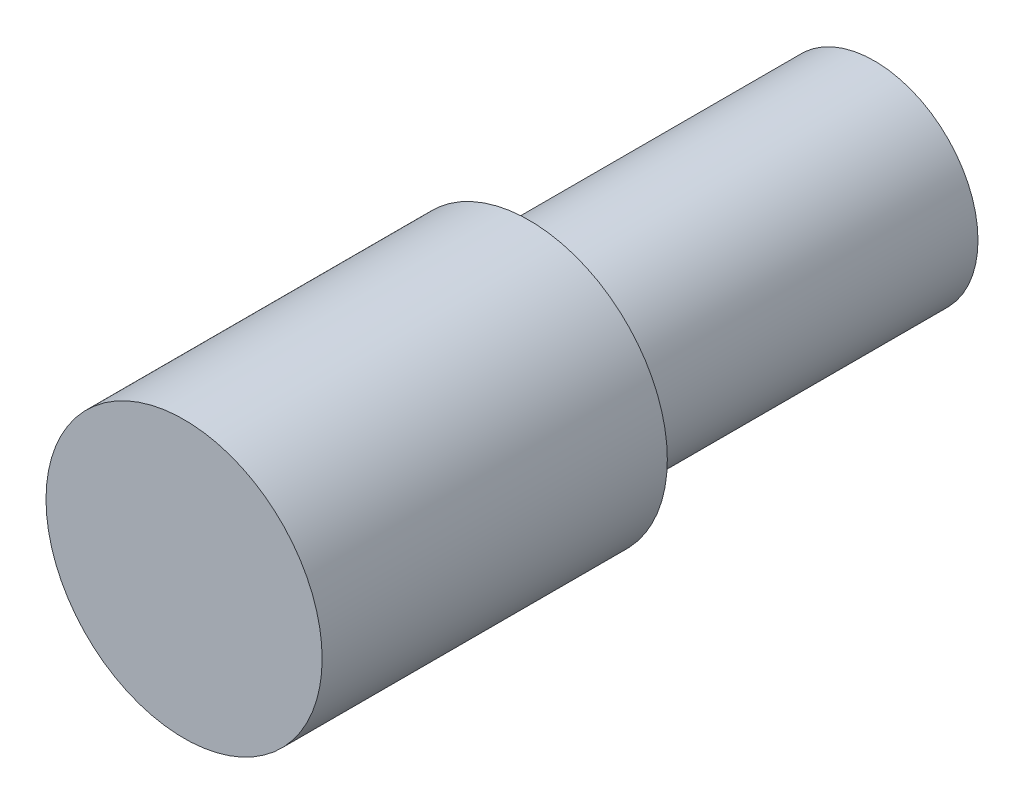
from build123d import *

# Parameters (mm, degrees)
SKETCH1_R           = 1.5
BOSS_EXTRUDE1_DEPTH = 5
SKETCH2_R           = 2
BOSS_EXTRUDE2_DEPTH = 5


with BuildPart() as part:
    # Sketch1 → Boss-Extrude1 (new body)
    with BuildSketch(Plane.XY):
        Circle(SKETCH1_R)
    extrude(amount=BOSS_EXTRUDE1_DEPTH)

    # Sketch2 → Boss-Extrude2 (add)
    with BuildSketch(Plane.XY.offset(5)):
        Circle(SKETCH2_R)
    extrude(amount=BOSS_EXTRUDE2_DEPTH)


solid = part.part
